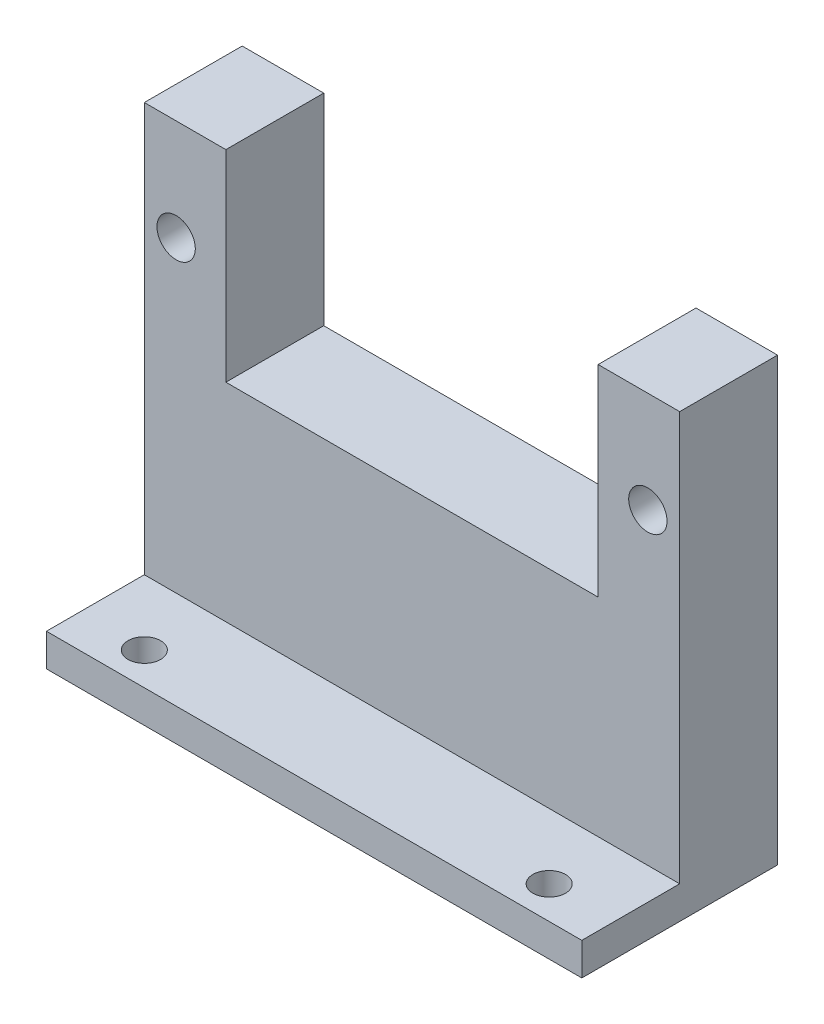
from build123d import *

# Parameters (mm, degrees)
SKETCH2_R           = 1.175
BOSS_EXTRUDE2_DEPTH = 6
SKETCH4_W           = 32.82
SKETCH4_H           = 6
SKETCH4_R           = 1
BOSS_EXTRUDE3_DEPTH = 2


with BuildPart() as part:
    # Sketch2 → Boss-Extrude2 (new body)
    with BuildSketch(Plane.XY):
        Polygon((0, 0), (32.82, 0), (32.82, 14.72), (32.82, 27.07), (27.82, 27.07), (27.82, 14.72), (5, 14.72), (5, 27.07), (0, 27.07), (0, 20), align=None)
        with Locations((30.87, 20.87)):
            Circle(SKETCH2_R, mode=Mode.SUBTRACT)
        with Locations(Location((1.95, 20.87, 0), (0, 0, 180))):
            Circle(SKETCH2_R, mode=Mode.SUBTRACT)
    extrude(amount=BOSS_EXTRUDE2_DEPTH)

    # Sketch4 → Boss-Extrude3 (add)
    with BuildSketch(Plane(origin=(0, 0, 0), x_dir=(1, 0, 0), z_dir=(0, 1, 0))):
        with Locations((16.41, -9)):
            Rectangle(SKETCH4_W, SKETCH4_H)
        with Locations(Location((4, -10, 0), (0, 0, 270))):
            Circle(SKETCH4_R, mode=Mode.SUBTRACT)
        with Locations(Location((28.82, -10, 0), (0, 0, 270))):
            Circle(SKETCH4_R, mode=Mode.SUBTRACT)
    extrude(amount=BOSS_EXTRUDE3_DEPTH)


solid = part.part
